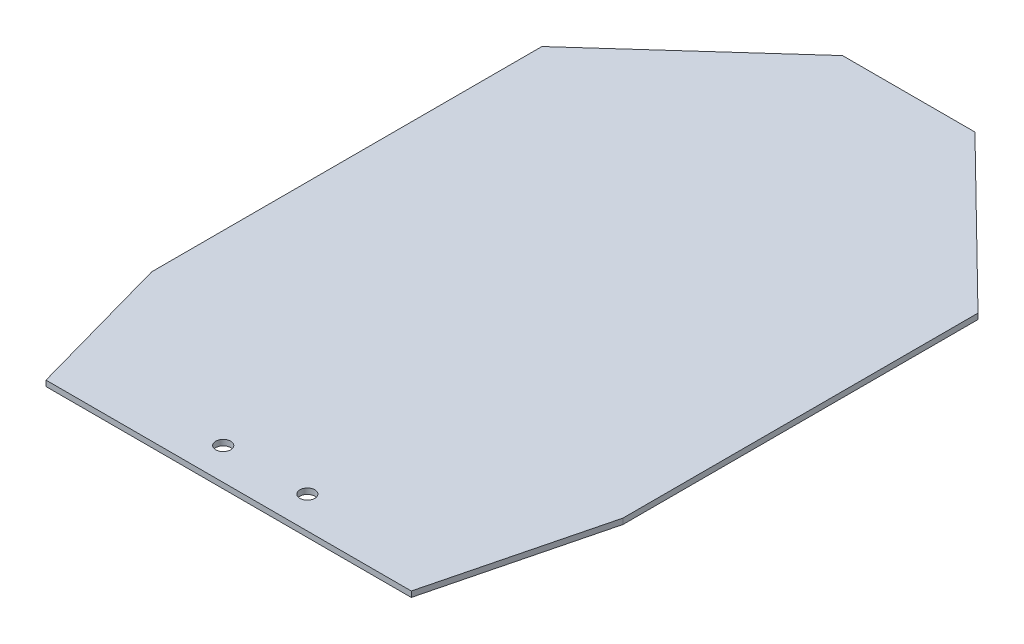
from build123d import *

# Parameters (mm, degrees)
RESSALTO_EXTRUS_O1_DEPTH = 3
ESBO_O2_R                = 4
CORTE_EXTRUS_O1_DEPTH    = 219.690902409


with BuildPart() as part:
    # Esboço1 → Ressalto-extrusão1 (new body)
    with BuildSketch(Plane(origin=(0, 0, 0), x_dir=(1, 0, 0), z_dir=(0, 1, 0))):
        Polygon((97.255710926, -182.75), (120.079758063, -92.387934551), (120.079758063, 97.512065449), (35.4, 180.55), (-35.4, 180.55), (-119.989494029, 104.35), (-119.989494029, -104.35), (-98.094289074, -182.75), align=None)
    extrude(amount=RESSALTO_EXTRUS_O1_DEPTH)

    # Esboço2 → Corte-extrusão1 (cut, through all)
    with BuildSketch(Plane(origin=(0, 3, 0), x_dir=(1, 0, 0), z_dir=(0, 1, 0))):
        with Locations(Location((24.579758063, -165.65, 0), (0, 0, 270))):
            Circle(ESBO_O2_R)
        with Locations(Location((-20.420241937, -165.65, 0), (0, 0, 270))):
            Circle(ESBO_O2_R)
    extrude(amount=-CORTE_EXTRUS_O1_DEPTH, mode=Mode.SUBTRACT)


solid = part.part
